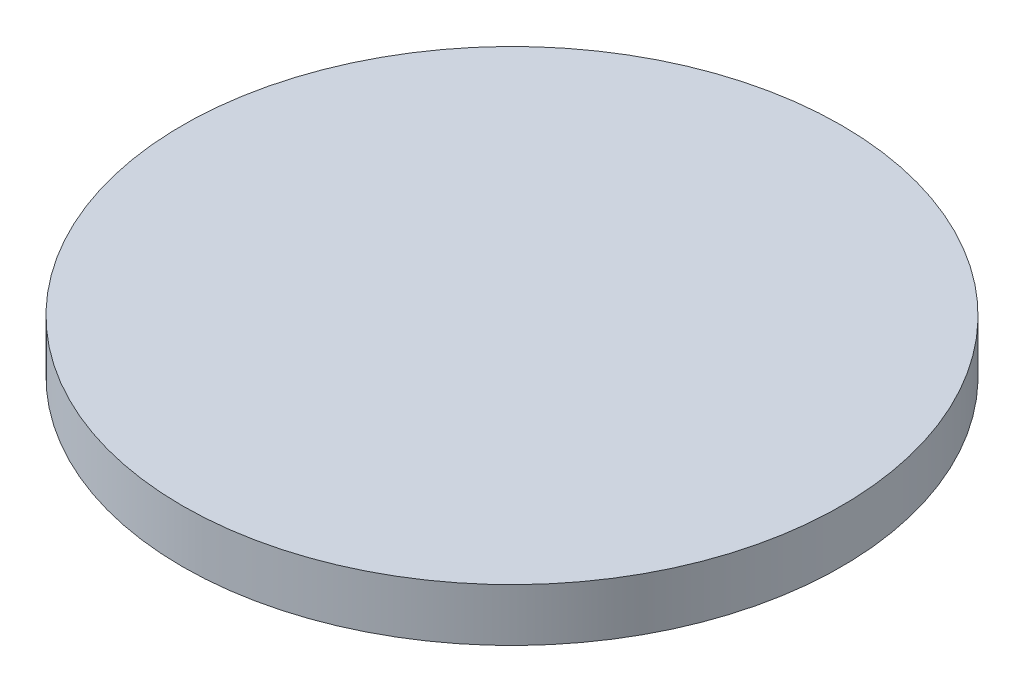
from build123d import *

# Parameters (mm, degrees)
SKETCH1_R           = 62.5
BOSS_EXTRUDE1_DEPTH = 10


with BuildPart() as part:
    # Sketch1 → Boss-Extrude1 (new body)
    with BuildSketch(Plane(origin=(0, 0, 0), x_dir=(1, 0, 0), z_dir=(0, 1, 0))):
        with Locations(Location((0, 0, 0), (0, 0, 270))):
            Circle(SKETCH1_R)
    extrude(amount=BOSS_EXTRUDE1_DEPTH)


solid = part.part
